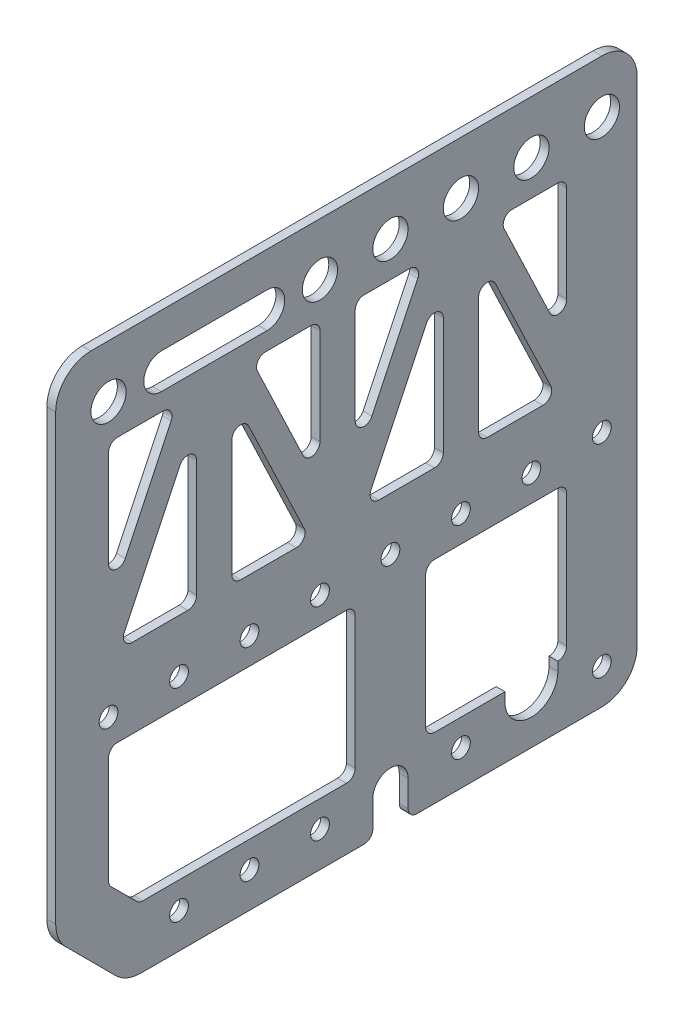
from build123d import *

# Parameters (mm, degrees)
SKETCH1_R           = 3.3782
SKETCH1_R_2         = 6.35
BOSS_EXTRUDE1_DEPTH = 1.5875
FILLET1_R           = 12.7


with BuildPart() as part:
    # Sketch1 → Boss-Extrude1 (new, symmetric)
    with BuildSketch(Plane(origin=(0, 0, 0), x_dir=(0, 0, -1), z_dir=(1, 0, 0))):
        with BuildLine():
            Line((0, 0), (0, 203.2))
            Line((0, 203.2), (-209.55, 203.2))
            Line((-209.55, 203.2), (-209.55, 25.4))
            Line((-209.55, 25.4), (-184.15, 0))
            Line((-184.15, 0), (-98.425, 0))
            ThreePointArc((-98.425, 0), (-96.17993597, 0.92993597), (-95.25, 3.175))
            Line((-95.25, 3.175), (-95.25, 12.7))
            ThreePointArc((-95.25, 12.7), (-88.9, 19.05), (-82.55, 12.7))
            Line((-82.55, 12.7), (-82.55, 3.175))
            ThreePointArc((-82.55, 3.175), (-81.62006403, 0.92993597), (-79.375, 0))
            Line((-79.375, 0), (0, 0))
        make_face()
        with Locations((-12.7, 12.7)):
            Circle(SKETCH1_R, mode=Mode.SUBTRACT)
        with Locations((-63.5, 12.7)):
            Circle(SKETCH1_R, mode=Mode.SUBTRACT)
        with Locations((-114.3, 12.7)):
            Circle(SKETCH1_R, mode=Mode.SUBTRACT)
        with Locations((-12.7, 85.725)):
            Circle(SKETCH1_R, mode=Mode.SUBTRACT)
        with Locations((-38.1, 85.725)):
            Circle(SKETCH1_R, mode=Mode.SUBTRACT)
        with Locations((-63.5, 85.725)):
            Circle(SKETCH1_R, mode=Mode.SUBTRACT)
        with Locations((-88.9, 85.725)):
            Circle(SKETCH1_R, mode=Mode.SUBTRACT)
        with Locations((-12.7, 184.15)):
            Circle(SKETCH1_R_2, mode=Mode.SUBTRACT)
        with Locations((-38.1, 184.15)):
            Circle(SKETCH1_R_2, mode=Mode.SUBTRACT)
        with Locations((-63.5, 184.15)):
            Circle(SKETCH1_R_2, mode=Mode.SUBTRACT)
        with Locations((-88.9, 184.15)):
            Circle(SKETCH1_R_2, mode=Mode.SUBTRACT)
        with Locations((-114.3, 184.15)):
            Circle(SKETCH1_R_2, mode=Mode.SUBTRACT)
        with Locations((-190.5, 184.15)):
            Circle(SKETCH1_R_2, mode=Mode.SUBTRACT)
        with Locations((-139.7, 12.7)):
            Circle(SKETCH1_R, mode=Mode.SUBTRACT)
        with Locations((-165.1, 12.7)):
            Circle(SKETCH1_R, mode=Mode.SUBTRACT)
        with Locations((-114.3, 85.725)):
            Circle(SKETCH1_R, mode=Mode.SUBTRACT)
        with Locations((-139.7, 85.725)):
            Circle(SKETCH1_R, mode=Mode.SUBTRACT)
        with Locations((-165.1, 85.725)):
            Circle(SKETCH1_R, mode=Mode.SUBTRACT)
        with Locations((-190.5, 85.725)):
            Circle(SKETCH1_R, mode=Mode.SUBTRACT)
        with BuildLine():
            Line((-76.2, 73.025), (-76.2, 25.4))
            ThreePointArc((-76.2, 25.4), (-75.27006403, 23.15493597), (-73.025, 22.225))
            Line((-73.025, 22.225), (-47.625, 22.225))
            Line((-47.625, 22.225), (-47.625, 19.05))
            ThreePointArc((-47.625, 19.05), (-38.1, 9.525), (-28.575, 19.05))
            Line((-28.575, 19.05), (-28.575, 22.225))
            ThreePointArc((-28.575, 22.225), (-26.32993597, 23.15493597), (-25.4, 25.4))
            Line((-25.4, 25.4), (-25.4, 73.025))
            ThreePointArc((-25.4, 73.025), (-26.32993597, 75.27006403), (-28.575, 76.2))
            Line((-28.575, 76.2), (-73.025, 76.2))
            ThreePointArc((-73.025, 76.2), (-75.27006403, 75.27006403), (-76.2, 73.025))
        make_face(mode=Mode.SUBTRACT)
        with BuildLine():
            Line((-33.945106311, 104.775), (-53.975, 104.775))
            ThreePointArc((-53.975, 104.775), (-56.22006403, 105.70493597), (-57.15, 107.95))
            Line((-57.15, 107.95), (-57.15, 150.012776746))
            ThreePointArc((-57.15, 150.012776746), (-54.674723761, 153.109712596), (-51.108417853, 151.377815864))
            Line((-51.108417853, 151.377815864), (-31.078524164, 109.315039118))
            ThreePointArc((-31.078524164, 109.315039118), (-31.260462555, 106.254915076), (-33.945106311, 104.775))
        make_face(mode=Mode.SUBTRACT)
        with BuildLine():
            Line((-25.4, 133.597084881), (-25.4, 168.275))
            ThreePointArc((-25.4, 168.275), (-26.32993597, 170.52006403), (-28.575, 171.45))
            Line((-28.575, 171.45), (-45.088292914, 171.45))
            ThreePointArc((-45.088292914, 171.45), (-47.77293667, 169.970084924), (-47.954875061, 166.909960882))
            Line((-47.954875061, 166.909960882), (-31.441582147, 132.232045763))
            ThreePointArc((-31.441582147, 132.232045763), (-27.875276239, 130.500149031), (-25.4, 133.597084881))
        make_face(mode=Mode.SUBTRACT)
        with BuildLine():
            Line((-180.364167607, 23.15493597), (-189.57006403, 32.360832393))
            ThreePointArc((-189.57006403, 32.360832393), (-190.258317516, 33.390876526), (-190.5, 34.605896424))
            Line((-190.5, 34.605896424), (-190.5, 73.025))
            ThreePointArc((-190.5, 73.025), (-189.57006403, 75.27006403), (-187.325, 76.2))
            Line((-187.325, 76.2), (-104.775, 76.2))
            ThreePointArc((-104.775, 76.2), (-102.52993597, 75.27006403), (-101.6, 73.025))
            Line((-101.6, 73.025), (-101.6, 25.4))
            ThreePointArc((-101.6, 25.4), (-102.52993597, 23.15493597), (-104.775, 22.225))
            Line((-104.775, 22.225), (-178.119103576, 22.225))
            ThreePointArc((-178.119103576, 22.225), (-179.334123474, 22.466682484), (-180.364167607, 23.15493597))
        make_face(mode=Mode.SUBTRACT)
        with BuildLine():
            Line((-79.045124939, 166.909960882), (-95.558417853, 132.232045763))
            ThreePointArc((-95.558417853, 132.232045763), (-99.124723761, 130.500149031), (-101.6, 133.597084881))
            Line((-101.6, 133.597084881), (-101.6, 168.275))
            ThreePointArc((-101.6, 168.275), (-100.67006403, 170.52006403), (-98.425, 171.45))
            Line((-98.425, 171.45), (-81.911707086, 171.45))
            ThreePointArc((-81.911707086, 171.45), (-79.22706333, 169.970084924), (-79.045124939, 166.909960882))
        make_face(mode=Mode.SUBTRACT)
        with BuildLine():
            Line((-75.891582147, 151.377815864), (-95.921475836, 109.315039118))
            ThreePointArc((-95.921475836, 109.315039118), (-95.739537445, 106.254915076), (-93.054893689, 104.775))
            Line((-93.054893689, 104.775), (-73.025, 104.775))
            ThreePointArc((-73.025, 104.775), (-70.77993597, 105.70493597), (-69.85, 107.95))
            Line((-69.85, 107.95), (-69.85, 150.012776746))
            ThreePointArc((-69.85, 150.012776746), (-72.325276239, 153.109712596), (-75.891582147, 151.377815864))
        make_face(mode=Mode.SUBTRACT)
        with BuildLine():
            Line((-122.845106311, 104.775), (-142.875, 104.775))
            ThreePointArc((-142.875, 104.775), (-145.12006403, 105.70493597), (-146.05, 107.95))
            Line((-146.05, 107.95), (-146.05, 150.012776746))
            ThreePointArc((-146.05, 150.012776746), (-143.574723761, 153.109712596), (-140.008417853, 151.377815864))
            Line((-140.008417853, 151.377815864), (-119.978524164, 109.315039118))
            ThreePointArc((-119.978524164, 109.315039118), (-120.160462555, 106.254915076), (-122.845106311, 104.775))
        make_face(mode=Mode.SUBTRACT)
        with BuildLine():
            Line((-114.3, 133.597084881), (-114.3, 168.275))
            ThreePointArc((-114.3, 168.275), (-115.22993597, 170.52006403), (-117.475, 171.45))
            Line((-117.475, 171.45), (-133.988292914, 171.45))
            ThreePointArc((-133.988292914, 171.45), (-136.67293667, 169.970084924), (-136.854875061, 166.909960882))
            Line((-136.854875061, 166.909960882), (-120.341582147, 132.232045763))
            ThreePointArc((-120.341582147, 132.232045763), (-116.775276239, 130.500149031), (-114.3, 133.597084881))
        make_face(mode=Mode.SUBTRACT)
        with BuildLine():
            Line((-167.945124939, 166.909960882), (-184.458417853, 132.232045763))
            ThreePointArc((-184.458417853, 132.232045763), (-188.024723761, 130.500149031), (-190.5, 133.597084881))
            Line((-190.5, 133.597084881), (-190.5, 168.275))
            ThreePointArc((-190.5, 168.275), (-189.57006403, 170.52006403), (-187.325, 171.45))
            Line((-187.325, 171.45), (-170.811707086, 171.45))
            ThreePointArc((-170.811707086, 171.45), (-168.12706333, 169.970084924), (-167.945124939, 166.909960882))
        make_face(mode=Mode.SUBTRACT)
        with BuildLine():
            Line((-164.791582147, 151.377815864), (-184.821475836, 109.315039118))
            ThreePointArc((-184.821475836, 109.315039118), (-184.639537445, 106.254915076), (-181.954893689, 104.775))
            Line((-181.954893689, 104.775), (-161.925, 104.775))
            ThreePointArc((-161.925, 104.775), (-159.67993597, 105.70493597), (-158.75, 107.95))
            Line((-158.75, 107.95), (-158.75, 150.012776746))
            ThreePointArc((-158.75, 150.012776746), (-161.225276239, 153.109712596), (-164.791582147, 151.377815864))
        make_face(mode=Mode.SUBTRACT)
        with BuildLine():
            Line((-133.35, 177.8), (-171.45, 177.8))
            ThreePointArc((-171.45, 177.8), (-177.8, 184.15), (-171.45, 190.5))
            Line((-171.45, 190.5), (-133.35, 190.5))
            ThreePointArc((-133.35, 190.5), (-127, 184.15), (-133.35, 177.8))
        make_face(mode=Mode.SUBTRACT)
    extrude(amount=BOSS_EXTRUDE1_DEPTH, both=True)

    # Fillet1
    fillet1_edges = [part.edges().sort_by_distance(p)[0] for p in [
        (0, 0, 184.15),
        (0, 25.4, 209.55),
        (0, 203.2, 209.55),
        (0, 203.2, 0),
        (0, 0, 0),
    ]]
    fillet(fillet1_edges, radius=FILLET1_R)


solid = part.part
